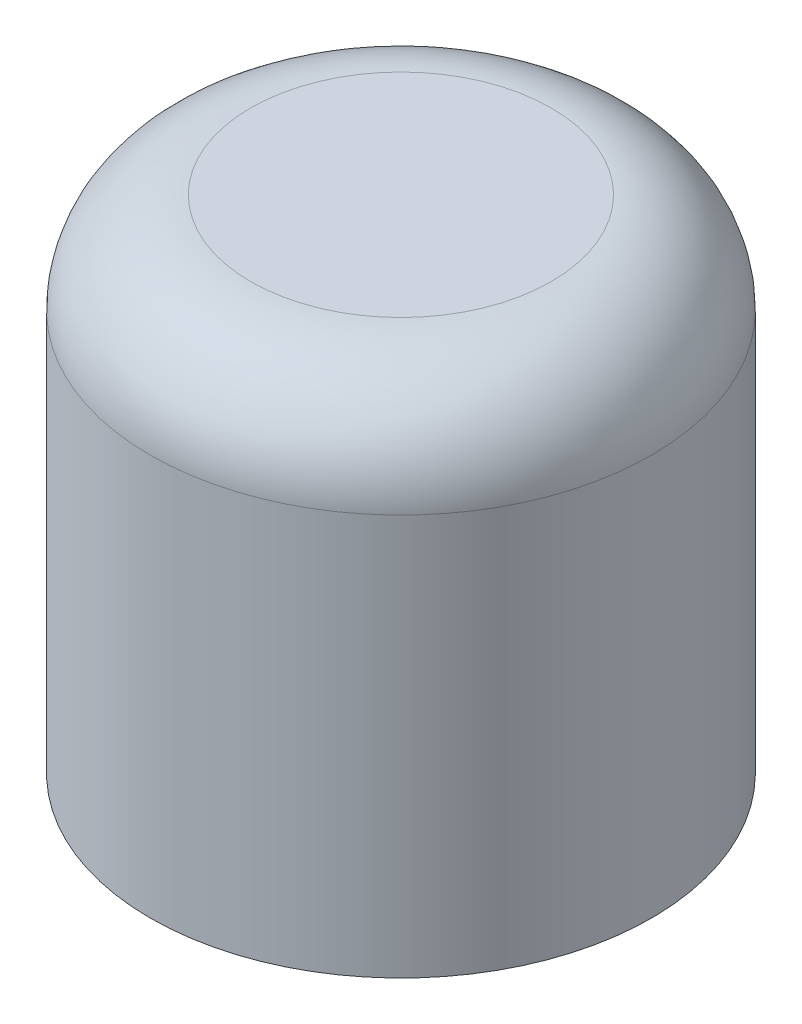
from build123d import *

# Parameters (mm, degrees)
SKETCH1_R           = 50
BOSS_EXTRUDE1_DEPTH = 100
FILLET1_R           = 20
SKETCH4_R           = 45
CUT_EXTRUDE1_DEPTH  = 80


with BuildPart() as part:
    # Sketch1 → Boss-Extrude1 (new body)
    with BuildSketch(Plane(origin=(0, 0, 0), x_dir=(1, 0, 0), z_dir=(0, 1, 0))):
        with Locations(Location((0, 0, 0), (0, 0, 270))):
            Circle(SKETCH1_R)
    extrude(amount=BOSS_EXTRUDE1_DEPTH)

    # Fillet1
    fillet1_edges = [part.edges().sort_by_distance(p)[0] for p in [
        (0, 100, -50),
    ]]
    fillet(fillet1_edges, radius=FILLET1_R)

    # Sketch4 → Cut-Extrude1 (cut)
    with BuildSketch(Plane.XZ):
        with Locations(Location((0, 0, 0), (0, 0, 270))):
            Circle(SKETCH4_R)
    extrude(amount=-CUT_EXTRUDE1_DEPTH, mode=Mode.SUBTRACT)


solid = part.part
